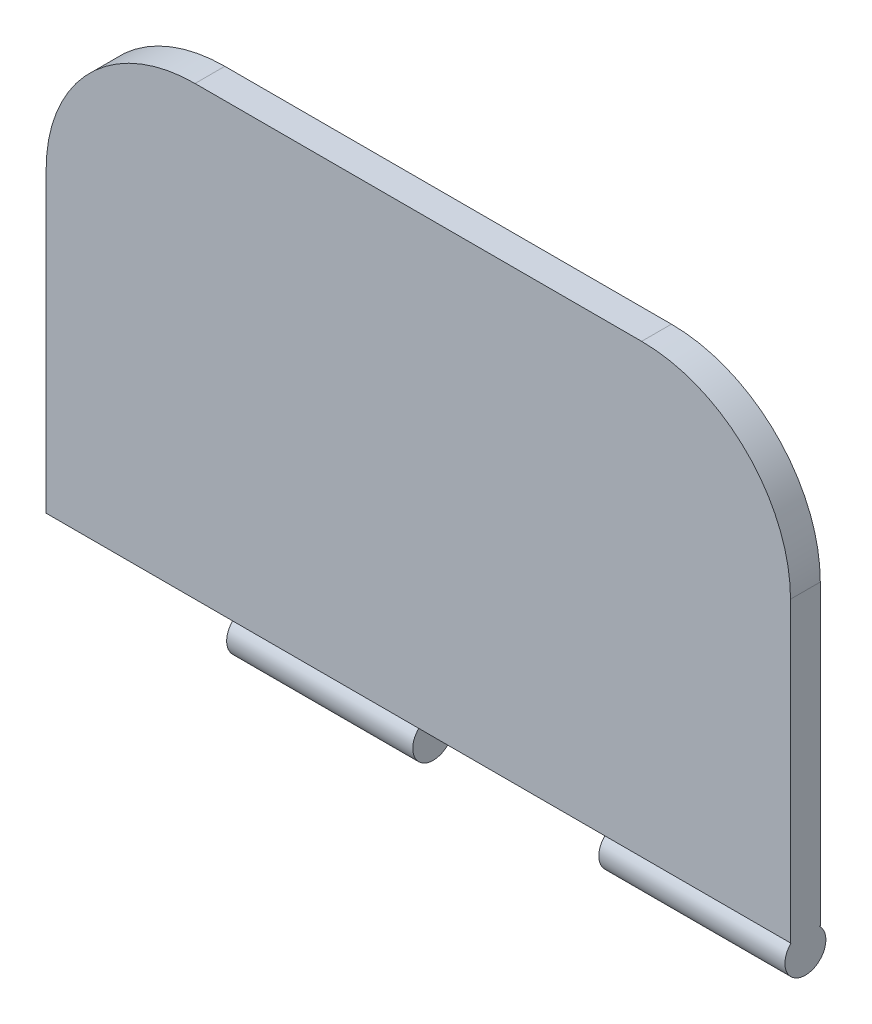
from build123d import *

# Parameters (mm, degrees)
BOSS_EXTRUDE1_DEPTH = 2
SKETCH3_R           = 1.375
CUT_EXTRUDE1_DEPTH  = 50
SKETCH3_2_R         = 1.375
BOSS_EXTRUDE2_DEPTH = 12.5
SKETCH5_R           = 1.375
BOSS_EXTRUDE3_DEPTH = 12.5
SKETCH7_R           = 3.5
CUT_EXTRUDE2_DEPTH  = 1


with BuildPart() as part:
    # Sketch1 → Boss-Extrude1 (new body)
    with BuildSketch(Plane.XY):
        with BuildLine():
            Line((-15, 15), (15, 15))
            ThreePointArc((15, 15), (22.071067812, 12.071067812), (25, 5))
            Line((25, 5), (25, -15))
            Line((25, -15), (-25, -15))
            Line((-25, -15), (-25, 5))
            ThreePointArc((-25, 5), (-22.071067812, 12.071067812), (-15, 15))
        make_face()
    extrude(amount=BOSS_EXTRUDE1_DEPTH)

    # Sketch3 → Cut-Extrude1 (cut)
    with BuildSketch(Plane(origin=(25, 0, 0), x_dir=(0, 0, -1), z_dir=(1, 0, 0))):
        with Locations((-1, -16)):
            Circle(SKETCH3_R)
    extrude(amount=-CUT_EXTRUDE1_DEPTH, mode=Mode.SUBTRACT)

    # Sketch3<2> → Boss-Extrude2 (add)
    with BuildSketch(Plane(origin=(25, 0, 0), x_dir=(0, 0, -1), z_dir=(1, 0, 0))):
        with Locations((-1, -16)):
            Circle(SKETCH3_2_R)
    extrude(amount=-BOSS_EXTRUDE2_DEPTH)

    # Sketch5 → Boss-Extrude3 (add)
    with BuildSketch(Plane.ZY):
        with Locations((1, -16)):
            Circle(SKETCH5_R)
    extrude(amount=BOSS_EXTRUDE3_DEPTH)

    # Sketch7 → Cut-Extrude2 (cut)
    with BuildSketch(Plane(origin=(0, 0, 0), x_dir=(-1, 0, 0), z_dir=(0, 0, -1))):
        Circle(SKETCH7_R)
    extrude(amount=-CUT_EXTRUDE2_DEPTH, mode=Mode.SUBTRACT)


solid = part.part
